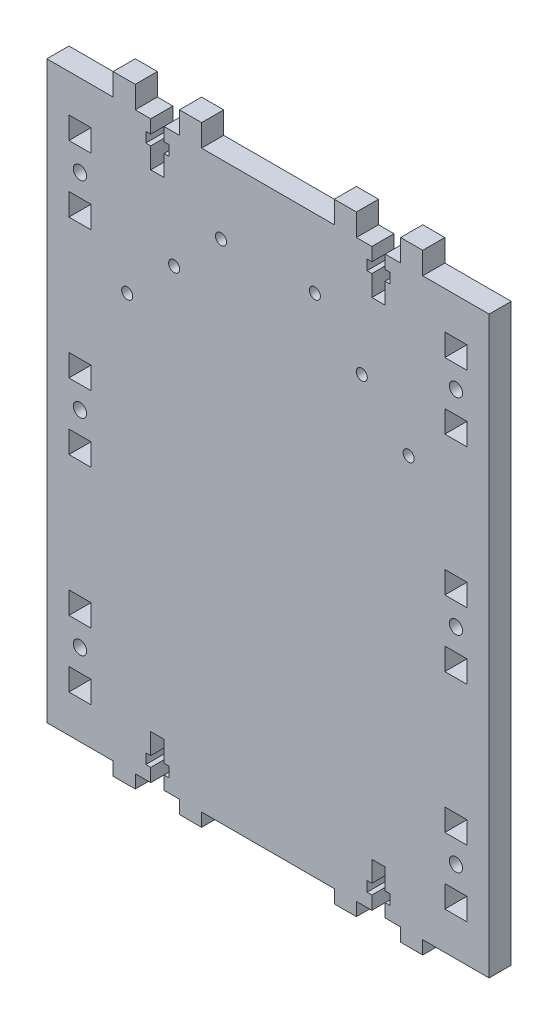
from build123d import *

# Parameters (mm, degrees)
SKETCH1_W           = 5
SKETCH1_H           = 5
SKETCH1_R           = 1.5
SKETCH1_R_2         = 1.25
BOSS_EXTRUDE1_DEPTH = 5


with BuildPart() as part:
    # Sketch1 → Boss-Extrude1 (new body)
    with BuildSketch(Plane.XY):
        Polygon((-50, 65), (-50, -65), (-35, -65), (-35, -68), (-30, -68), (-30, -65), (-26.5, -65), (-26.5, -62), (-27.6, -62), (-27.6, -59.7), (-26.5, -59.7), (-26.5, -55), (-23.5, -55), (-23.5, -59.7), (-22.4, -59.7), (-22.4, -62), (-23.5, -62), (-23.5, -65), (-20, -65), (-20, -68), (-15, -68), (-15, -65), (15, -65), (15, -68), (20, -68), (20, -65), (23.5, -65), (23.5, -62), (22.4, -62), (22.4, -59.7), (23.5, -59.7), (23.5, -55), (26.5, -55), (26.5, -59.7), (27.6, -59.7), (27.6, -62), (26.5, -62), (26.5, -65), (30, -65), (30, -68), (35, -68), (35, -65), (50, -65), (50, 65), (35, 65), (35, 70), (30, 70), (30, 65), (26.5, 65), (26.5, 62), (27.6, 62), (27.6, 59.7), (26.5, 59.7), (26.5, 55), (23.5, 55), (23.5, 59.7), (22.4, 59.7), (22.4, 62), (23.5, 62), (23.5, 65), (20, 65), (20, 70), (15, 70), (15, 65), (-15, 65), (-15, 70), (-20, 70), (-20, 65), (-23.5, 65), (-23.5, 62), (-22.4, 62), (-22.4, 59.7), (-23.5, 59.7), (-23.5, 55), (-26.5, 55), (-26.5, 59.7), (-27.6, 59.7), (-27.6, 62), (-26.5, 62), (-26.5, 65), (-30, 65), (-30, 70), (-35, 70), (-35, 65), align=None)
        with Locations((-42.5, -54)):
            Rectangle(SKETCH1_W, SKETCH1_H, mode=Mode.SUBTRACT)
        with Locations((-42.5, -46.5)):
            Circle(SKETCH1_R, mode=Mode.SUBTRACT)
        with Locations((-42.5, -39)):
            Rectangle(SKETCH1_W, SKETCH1_H, mode=Mode.SUBTRACT)
        with Locations((-42.5, -7.5)):
            Rectangle(SKETCH1_W, SKETCH1_H, mode=Mode.SUBTRACT)
        with Locations((-42.5, 0)):
            Circle(SKETCH1_R, mode=Mode.SUBTRACT)
        with Locations((42.5, -54)):
            Rectangle(SKETCH1_W, SKETCH1_H, mode=Mode.SUBTRACT)
        with Locations((42.5, -46.5)):
            Circle(SKETCH1_R, mode=Mode.SUBTRACT)
        with Locations((42.5, -39)):
            Rectangle(SKETCH1_W, SKETCH1_H, mode=Mode.SUBTRACT)
        with Locations((42.5, -7.5)):
            Rectangle(SKETCH1_W, SKETCH1_H, mode=Mode.SUBTRACT)
        with Locations((42.5, 0)):
            Circle(SKETCH1_R, mode=Mode.SUBTRACT)
        with Locations((-42.5, 7.5)):
            Rectangle(SKETCH1_W, SKETCH1_H, mode=Mode.SUBTRACT)
        with Locations((-31.819805153, 28.176796564)):
            Circle(SKETCH1_R_2, mode=Mode.SUBTRACT)
        with Locations((-42.5, 39)):
            Rectangle(SKETCH1_W, SKETCH1_H, mode=Mode.SUBTRACT)
        with Locations((-42.5, 46.5)):
            Circle(SKETCH1_R, mode=Mode.SUBTRACT)
        with Locations((-42.5, 54)):
            Rectangle(SKETCH1_W, SKETCH1_H, mode=Mode.SUBTRACT)
        with Locations((-21.213203436, 38.783398282)):
            Circle(SKETCH1_R_2, mode=Mode.SUBTRACT)
        with Locations((-10.606601718, 49.39)):
            Circle(SKETCH1_R_2, mode=Mode.SUBTRACT)
        with Locations((42.5, 7.5)):
            Rectangle(SKETCH1_W, SKETCH1_H, mode=Mode.SUBTRACT)
        with Locations((31.819805153, 28.176796564)):
            Circle(SKETCH1_R_2, mode=Mode.SUBTRACT)
        with Locations((10.606601718, 49.39)):
            Circle(SKETCH1_R_2, mode=Mode.SUBTRACT)
        with Locations((21.213203436, 38.783398282)):
            Circle(SKETCH1_R_2, mode=Mode.SUBTRACT)
        with Locations((42.5, 39)):
            Rectangle(SKETCH1_W, SKETCH1_H, mode=Mode.SUBTRACT)
        with Locations((42.5, 46.5)):
            Circle(SKETCH1_R, mode=Mode.SUBTRACT)
        with Locations((42.5, 54)):
            Rectangle(SKETCH1_W, SKETCH1_H, mode=Mode.SUBTRACT)
    extrude(amount=BOSS_EXTRUDE1_DEPTH)


solid = part.part
